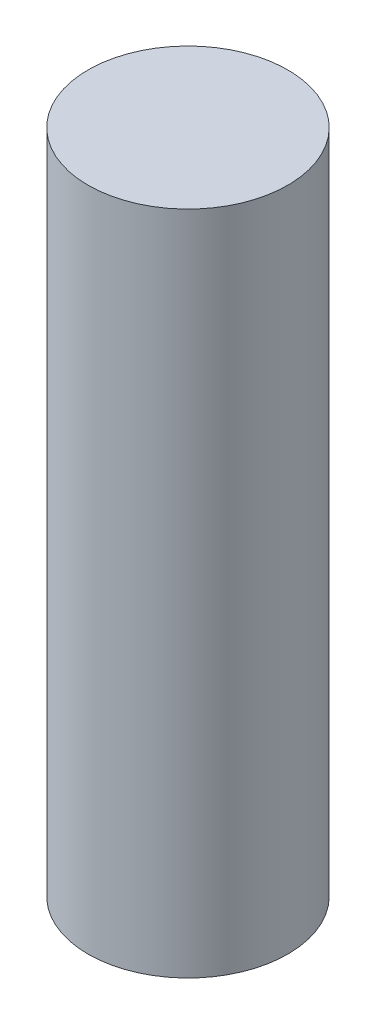
from build123d import *

# Parameters (mm, degrees)
SKETCH2_R           = 9.525
BOSS_EXTRUDE1_DEPTH = 63.5


with BuildPart() as part:
    # Sketch2 → Boss-Extrude1 (new body)
    with BuildSketch(Plane(origin=(0, 0, 0), x_dir=(1, 0, 0), z_dir=(0, 1, 0))):
        with Locations(Location((0, 0, 0), (0, 0, 270))):
            Circle(SKETCH2_R)
    extrude(amount=BOSS_EXTRUDE1_DEPTH)


solid = part.part
